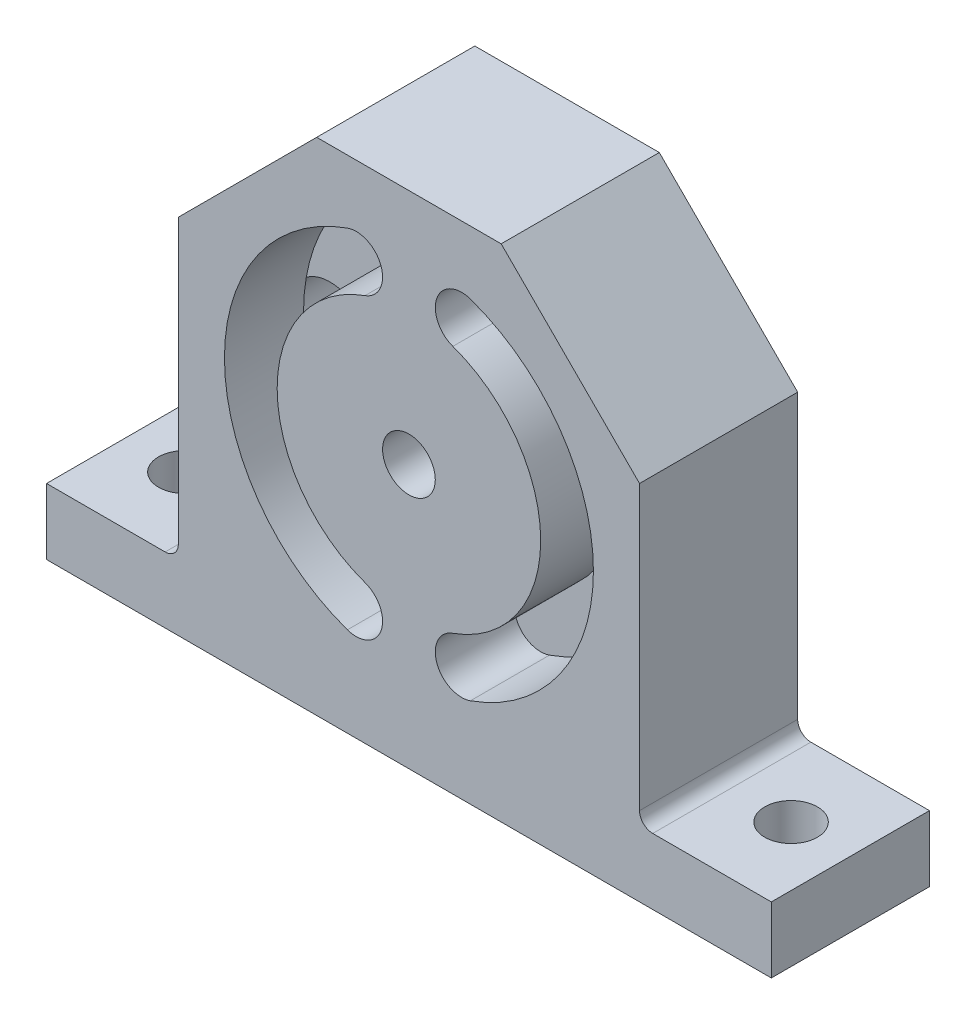
from build123d import *

# Parameters (mm, degrees)
BOSS_EXTRUDE1_DEPTH = 6
SKETCH2_R           = 2
CUT_EXTRUDE1_DEPTH  = 68.919069487
CUT_EXTRUDE2_DEPTH  = 6
SKETCH4_R           = 3
CUT_EXTRUDE3_DEPTH  = 6
SKETCH5_R           = 2
CUT_EXTRUDE4_DEPTH  = 65.420493634
FILLET1_R           = 1


with BuildPart() as part:
    # Sketch1 → Boss-Extrude1 (new, symmetric)
    with BuildSketch(Plane.XY):
        Polygon((0, 0), (55, 0), (55, 5), (45, 5), (45, 27.5), (34.5, 38), (20.5, 38), (10, 27.5), (10, 5), (0, 5), align=None)
    extrude(amount=BOSS_EXTRUDE1_DEPTH, both=True)

    # Sketch2 → Cut-Extrude1 (cut, through all)
    with BuildSketch(Plane.XY.offset(6)):
        with Locations((27.5, 20)):
            Circle(SKETCH2_R)
    extrude(amount=-CUT_EXTRUDE1_DEPTH, mode=Mode.SUBTRACT)

    # Sketch3 → Cut-Extrude2 (cut)
    with BuildSketch(Plane.XY.offset(6)):
        with BuildLine():
            ThreePointArc((24.166666667, 29.428090416), (17.5, 20), (24.166666667, 10.571909584))
            ThreePointArc((24.166666667, 10.571909584), (25.385618083, 8.019624834), (22.833333333, 6.800673418))
            ThreePointArc((22.833333333, 6.800673418), (13.5, 20), (22.833333333, 33.199326582))
            ThreePointArc((22.833333333, 33.199326582), (25.385618083, 31.980375166), (24.166666667, 29.428090416))
        make_face()
        with BuildLine():
            ThreePointArc((32.166666667, 6.800673418), (29.614381917, 8.019624834), (30.833333333, 10.571909584))
            ThreePointArc((30.833333333, 10.571909584), (37.5, 20), (30.833333333, 29.428090416))
            ThreePointArc((30.833333333, 29.428090416), (29.614381917, 31.980375166), (32.166666667, 33.199326582))
            ThreePointArc((32.166666667, 33.199326582), (41.5, 20), (32.166666667, 6.800673418))
        make_face()
    extrude(amount=-CUT_EXTRUDE2_DEPTH, mode=Mode.SUBTRACT)

    # Sketch4 → Cut-Extrude3 (cut)
    with BuildSketch(Plane(origin=(0, 0, -6), x_dir=(-1, 0, 0), z_dir=(0, 0, -1))):
        with Locations((-39.5, 20)):
            Circle(SKETCH4_R)
        with Locations((-15.5, 20)):
            Circle(SKETCH4_R)
    extrude(amount=-CUT_EXTRUDE3_DEPTH, mode=Mode.SUBTRACT)

    # Sketch5 → Cut-Extrude4 (cut, through all)
    with BuildSketch(Plane(origin=(0, 5, 0), x_dir=(1, 0, 0), z_dir=(0, 1, 0))):
        with Locations(Location((4.5, 0, 0), (0, 0, 180))):
            Circle(SKETCH5_R)
        with Locations(Location((50.5, 0, 0), (0, 0, 180))):
            Circle(SKETCH5_R)
    extrude(amount=-CUT_EXTRUDE4_DEPTH, mode=Mode.SUBTRACT)

    # Fillet1
    fillet1_edges = [part.edges().sort_by_distance(p)[0] for p in [
        (10, 5, 0),
        (45, 5, 0),
    ]]
    fillet(fillet1_edges, radius=FILLET1_R)


solid = part.part
